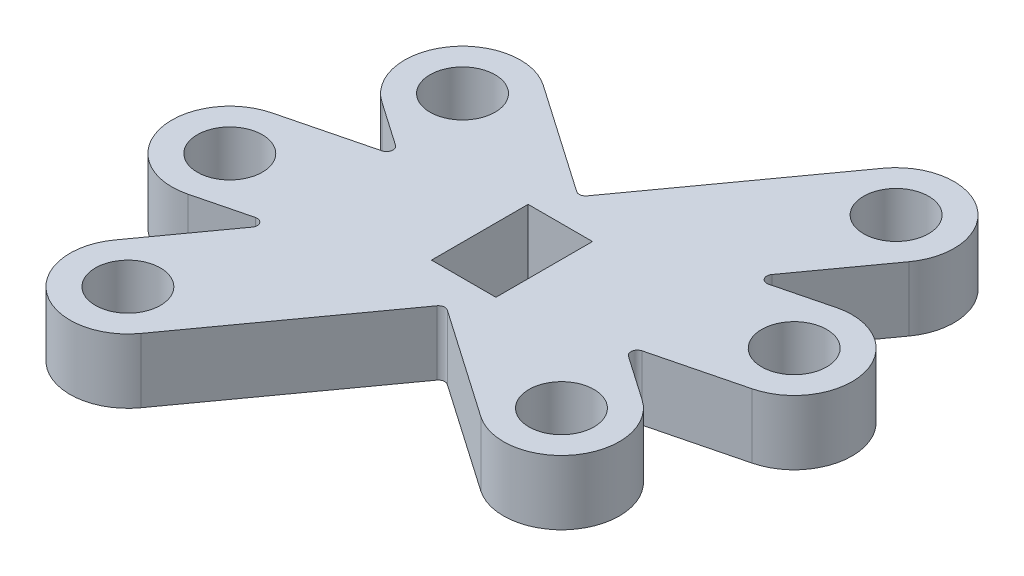
from build123d import *

# Parameters (mm, degrees)
SKETCH1_R           = 5.05
BOSS_EXTRUDE1_DEPTH = 10
FILLET1_R           = 1


with BuildPart() as part:
    # Sketch1 → Boss-Extrude1 (new body)
    # profile 1 of 14: a face of its own
    with BuildSketch(Plane(origin=(0, 0, 0), x_dir=(1, 0, 0), z_dir=(0, 1, 0))):
        Polygon((2.667006003, -23.808109615), (-5, -18.496177846), (-5, -33.48105), (-14.97816514, -33.48105), (-11.765381702, -35.706962749), (-4.621337732, -33.907173957), align=None)
    # profile 2 of 14: a face of its own
    with BuildSketch(Plane(origin=(0, 0, 0), x_dir=(1, 0, 0), z_dir=(0, 1, 0))):
        Polygon((-5.02183486, -18.48105), (-8.234724145, -16.255063917), (-15.378926884, -18.054892707), (-22.667198451, -28.153857051), (-15, -33.465922154), (-15, -18.48105), align=None)
    # profile 3 of 14: a face of its own
    with BuildSketch(Plane(origin=(0, 0, 0), x_dir=(1, 0, 0), z_dir=(0, 1, 0))):
        Polygon((-8.234724145, -16.255063917), (-12.131573163, -13.555210012), (-15.378926884, -18.054892707), align=None)
    # profile 4 of 14: a face of its own
    with BuildSketch(Plane(origin=(0, 0, 0), x_dir=(1, 0, 0), z_dir=(0, 1, 0))):
        Polygon((-7.868619286, -38.406756654), (-4.621337732, -33.907173957), (-11.765381702, -35.706962749), align=None)
    # profile 5 of 14: a face of its own
    with BuildSketch(Plane(origin=(0, 0, 0), x_dir=(1, 0, 0), z_dir=(0, 1, 0))):
        Polygon((-15, -33.465922154), (-22.667198451, -28.153857051), (-31.751988504, -40.742160048), (-11.765381702, -35.706962749), (-14.97816514, -33.48105), (-15, -33.48105), align=None)
    # profile 6 of 14: a face of its own
    with BuildSketch(Plane(origin=(0, 0, 0), x_dir=(1, 0, 0), z_dir=(0, 1, 0))):
        Polygon((-22.667198451, -28.153857051), (-15.378926884, -18.054892707), (-31.413179434, -22.094379046), align=None)
    # profile 7 of 14: a face of its own
    with BuildSketch(Plane(origin=(0, 0, 0), x_dir=(1, 0, 0), z_dir=(0, 1, 0))):
        Polygon((11.413073587, -29.86764762), (2.667006003, -23.808109615), (-4.621337732, -33.907173957), align=None)
    # profile 8 of 14: a face of its own
    with BuildSketch(Plane(origin=(0, 0, 0), x_dir=(1, 0, 0), z_dir=(0, 1, 0))):
        Polygon((11.751723888, -11.219906616), (-8.234724145, -16.255063917), (-5.02183486, -18.48105), (-5, -18.48105), (-5, -18.496177846), (2.667006003, -23.808109615), align=None)
    # profile 9 of 14: a face of its own
    with BuildSketch(Plane(origin=(0, 0, 0), x_dir=(1, 0, 0), z_dir=(0, 1, 0))):
        with BuildLine():
            Line((7.702026656, 13.927138243), (-12.131573163, -13.555210012))
            Line((-12.131573163, -13.555210012), (-8.234724145, -16.255063917))
            Line((-8.234724145, -16.255063917), (11.751723888, -11.219906616))
            Line((11.751723888, -11.219906616), (22.297973344, 3.393461757))
            ThreePointArc((22.297973344, 3.393461757), (20.266838243, 15.958273344), (7.702026656, 13.927138243))
        make_face()
        with Locations(Location((15, 8.6603, 0), (0, 0, 270))):
            Circle(SKETCH1_R, mode=Mode.SUBTRACT)
    # profile 10 of 14: a face of its own
    with BuildSketch(Plane(origin=(0, 0, 0), x_dir=(1, 0, 0), z_dir=(0, 1, 0))):
        with BuildLine():
            Line((-12.131573163, -13.555210012), (-29.874498452, -1.262379084))
            ThreePointArc((-29.874498452, -1.262379084), (-42.397920916, -3.534798452), (-40.125501548, -16.058220916))
            Line((-40.125501548, -16.058220916), (-31.413179434, -22.094379046))
            Line((-31.413179434, -22.094379046), (-15.378926884, -18.054892707))
            Line((-15.378926884, -18.054892707), (-12.131573163, -13.555210012))
        make_face()
        with Locations(Location((-35, -8.6603, 0), (0, 0, 270))):
            Circle(SKETCH1_R, mode=Mode.SUBTRACT)
    # profile 11 of 14: a face of its own
    with BuildSketch(Plane(origin=(0, 0, 0), x_dir=(1, 0, 0), z_dir=(0, 1, 0))):
        with BuildLine():
            Line((22.801341803, -8.43619216), (11.751723888, -11.219906616))
            Line((11.751723888, -11.219906616), (2.667006003, -23.808109615))
            Line((2.667006003, -23.808109615), (11.413073587, -29.86764762))
            Line((11.413073587, -29.86764762), (27.198658197, -25.89080784))
            ThreePointArc((27.198658197, -25.89080784), (33.72730784, -14.964841803), (22.801341803, -8.43619216))
        make_face()
        with Locations(Location((25, -17.1635, 0), (0, 0, 270))):
            Circle(SKETCH1_R, mode=Mode.SUBTRACT)
    # profile 12 of 14: a face of its own
    with BuildSketch(Plane(origin=(0, 0, 0), x_dir=(1, 0, 0), z_dir=(0, 1, 0))):
        with BuildLine():
            Line((20.125501548, -35.903879084), (11.413073587, -29.86764762))
            Line((11.413073587, -29.86764762), (-4.621337732, -33.907173957))
            Line((-4.621337732, -33.907173957), (-7.868619286, -38.406756654))
            Line((-7.868619286, -38.406756654), (9.874498452, -50.699720916))
            ThreePointArc((9.874498452, -50.699720916), (22.397920916, -48.427301548), (20.125501548, -35.903879084))
        make_face()
        with Locations(Location((15, -43.3018, 0), (0, 0, 270))):
            Circle(SKETCH1_R, mode=Mode.SUBTRACT)
    # profile 13 of 14: a face of its own
    with BuildSketch(Plane(origin=(0, 0, 0), x_dir=(1, 0, 0), z_dir=(0, 1, 0))):
        with BuildLine():
            Line((-11.765381702, -35.706962749), (-31.751988504, -40.742160048))
            Line((-31.751988504, -40.742160048), (-42.297973344, -55.355161757))
            ThreePointArc((-42.297973344, -55.355161757), (-40.266838243, -67.919973344), (-27.702026656, -65.888838243))
            Line((-27.702026656, -65.888838243), (-7.868619286, -38.406756654))
            Line((-7.868619286, -38.406756654), (-11.765381702, -35.706962749))
        make_face()
        with Locations(Location((-35, -60.622, 0), (0, 0, 270))):
            Circle(SKETCH1_R, mode=Mode.SUBTRACT)
    # profile 14 of 14: a face of its own
    with BuildSketch(Plane(origin=(0, 0, 0), x_dir=(1, 0, 0), z_dir=(0, 1, 0))):
        with BuildLine():
            Line((-22.667198451, -28.153857051), (-31.413179434, -22.094379046))
            Line((-31.413179434, -22.094379046), (-47.198658197, -26.07119216))
            ThreePointArc((-47.198658197, -26.07119216), (-53.72730784, -36.997158197), (-42.801341803, -43.52580784))
            Line((-42.801341803, -43.52580784), (-31.751988504, -40.742160048))
            Line((-31.751988504, -40.742160048), (-22.667198451, -28.153857051))
        make_face()
        with Locations(Location((-45, -34.7985, 0), (0, 0, 270))):
            Circle(SKETCH1_R, mode=Mode.SUBTRACT)
    extrude(amount=BOSS_EXTRUDE1_DEPTH)

    # Fillet1
    fillet1_edges = [part.edges().sort_by_distance(p)[0] for p in [
        (-31.751988504, 5, 40.742160048),
        (-31.413179434, 5, 22.094379046),
        (-12.131573163, 5, 13.555210012),
        (11.751723888, 5, 11.219906616),
        (11.413073587, 5, 29.86764762),
        (-7.868619286, 5, 38.406756654),
    ]]
    fillet(fillet1_edges, radius=FILLET1_R)


solid = part.part
